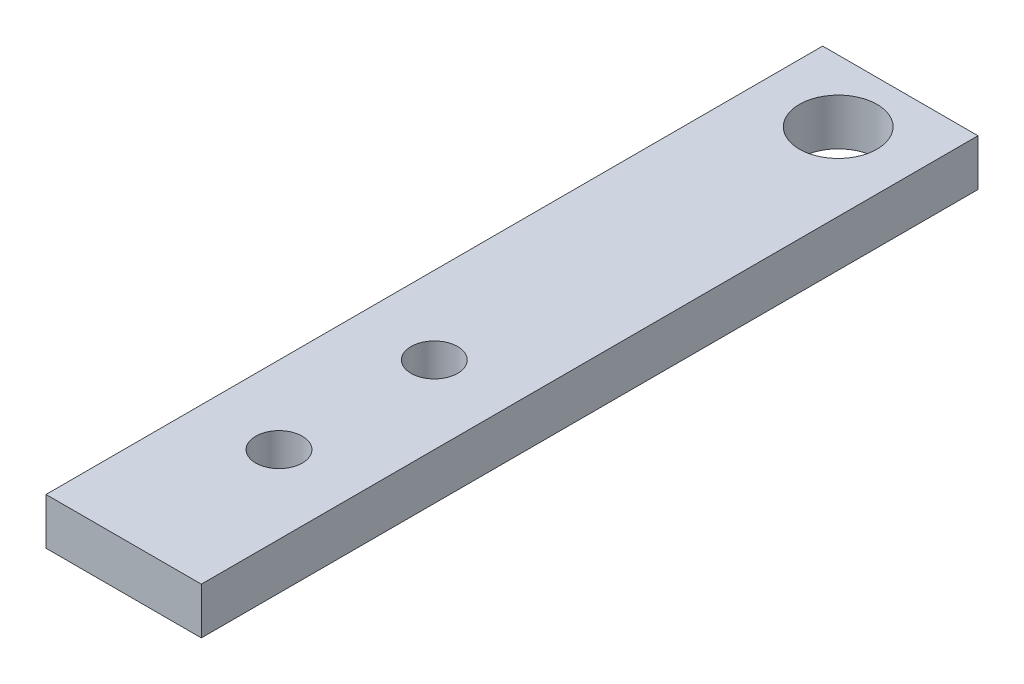
from build123d import *

# Parameters (mm, degrees)
SKETCH1_W           = 10
SKETCH1_H           = 50
SKETCH1_R           = 1.5
SKETCH1_R_2         = 2.5
BOSS_EXTRUDE1_DEPTH = 3


with BuildPart() as part:
    # Sketch1 → Boss-Extrude1 (new body)
    with BuildSketch(Plane(origin=(0, 0, 0), x_dir=(1, 0, 0), z_dir=(0, 1, 0))):
        Rectangle(SKETCH1_W, SKETCH1_H)
        with Locations(Location((0, -15, 0), (0, 0, 270))):
            Circle(SKETCH1_R, mode=Mode.SUBTRACT)
        with Locations(Location((0, -5, 0), (0, 0, 270))):
            Circle(SKETCH1_R, mode=Mode.SUBTRACT)
        with Locations(Location((0, 21, 0), (0, 0, 270))):
            Circle(SKETCH1_R_2, mode=Mode.SUBTRACT)
    extrude(amount=BOSS_EXTRUDE1_DEPTH)


solid = part.part
